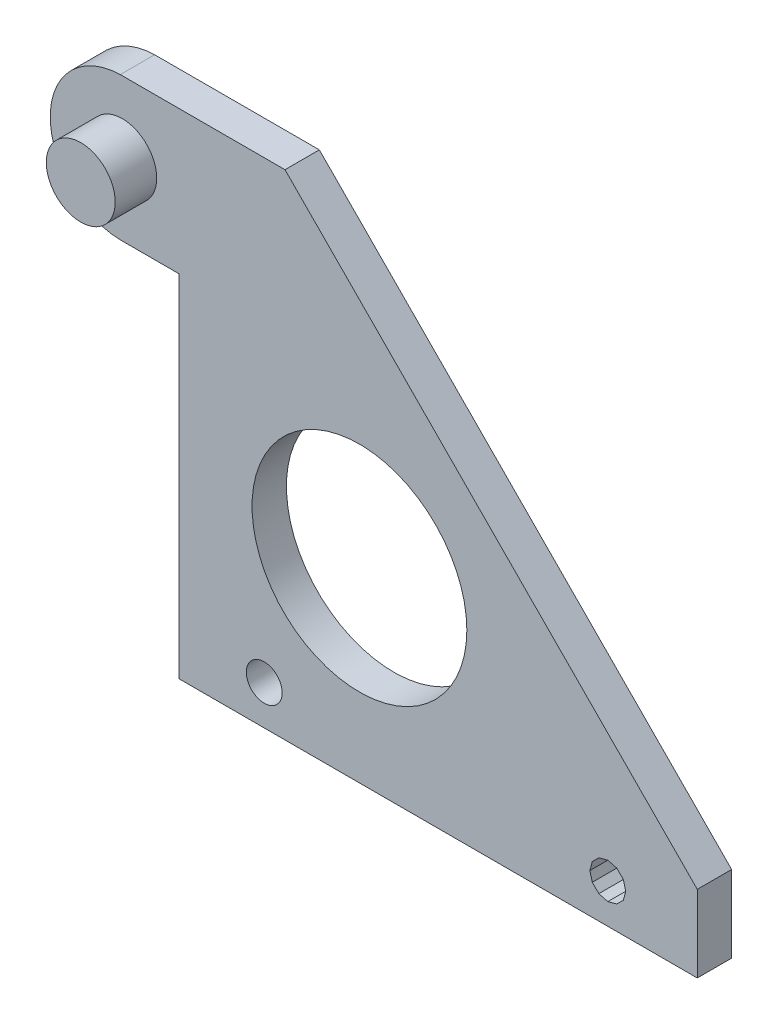
from build123d import *

# Parameters (mm, degrees)
BOSS_EXTRU_1_DEPTH      = 2.400000114
ESQUISSE9_W             = 36.19999811
ESQUISSE9_H             = 2.400000114
BOSS_EXTRU_2_DEPTH      = 5.365243182
ESQUISSE14_R            = 7.502289609
ENL_V_MAT_EXTRU_1_DEPTH = 72.901671136
ENL_V_MAT_EXTRU_2_DEPTH = 72.901671136
ESQUISSE25_R            = 1.252758793
ENL_V_MAT_EXTRU_3_DEPTH = 72.901671136
ESQUISSE28_R            = 2.406964412
BOSS_EXTRU_3_DEPTH      = 2.9


with BuildPart() as part:
    # Esquisse4 → Boss.-Extru.1 (new body)
    with BuildSketch(Plane.XY.offset(2.400000114)):
        with BuildLine():
            Line((-20.100001246, -24.634756148), (-48.900358379, 4.499999806))
            Line((-48.900358379, 4.499999806), (-60.405611992, 4.499999806))
            ThreePointArc((-60.405611992, 4.499999806), (-65.300002694, -0.500000082), (-60.405611992, -5.49999997))
            Line((-60.405611992, -5.49999997), (-56.299999356, -5.49999997))
            Line((-56.299999356, -5.49999997), (-56.299999356, -24.634756148))
            Line((-56.299999356, -24.634756148), (-20.100001246, -24.634756148))
        make_face()
    extrude(amount=-BOSS_EXTRU_1_DEPTH)

    # Esquisse9 → Boss.-Extru.2 (add)
    with BuildSketch(Plane(origin=(0, -24.634756148, 0), x_dir=(-1, 0, 0), z_dir=(0, -1, 0))):
        with Locations((38.200000301, -1.200000057)):
            Rectangle(ESQUISSE9_W, ESQUISSE9_H)
    extrude(amount=BOSS_EXTRU_2_DEPTH)

    # Esquisse14 → Enlèv. mat.-Extru.1 (cut, through all)
    with BuildSketch(Plane.XY.offset(2.400000114)):
        with Locations((-43.700002134, -16.999939794)):
            Circle(ESQUISSE14_R)
    extrude(amount=-ENL_V_MAT_EXTRU_1_DEPTH, mode=Mode.SUBTRACT)

    # Esquisse19 → Enlèv. mat.-Extru.2 (cut, through all)
    with BuildSketch(Plane.XY.offset(2.400000114)):
        Polygon((-26.350000873, -28.503000736), (-25.724001229, -28.334999457), (-25.264998898, -27.875998989), (-25.096999481, -27.249999344), (-25.264998898, -26.6239997), (-25.724001229, -26.165001094), (-26.350000873, -25.998000056), (-26.976000518, -26.165001094), (-27.434999123, -26.6239997), (-27.602000162, -27.249999344), (-27.434999123, -27.875998989), (-26.976000518, -28.334999457), align=None)
    extrude(amount=-ENL_V_MAT_EXTRU_2_DEPTH, mode=Mode.SUBTRACT)

    # Esquisse25 → Enlèv. mat.-Extru.3 (cut, through all)
    with BuildSketch(Plane(origin=(0, 0, 0), x_dir=(-1, 0, 0), z_dir=(0, 0, -1))):
        with Locations((50.350001082, -27.250241944)):
            Circle(ESQUISSE25_R)
    extrude(amount=-ENL_V_MAT_EXTRU_3_DEPTH, mode=Mode.SUBTRACT)

    # Esquisse28 → Boss.-Extru.3 (add)
    with BuildSketch(Plane.XY.offset(2.400000114)):
        with Locations((-60.267728087, -0.4991006)):
            Circle(ESQUISSE28_R)
    extrude(amount=BOSS_EXTRU_3_DEPTH)


solid = part.part
